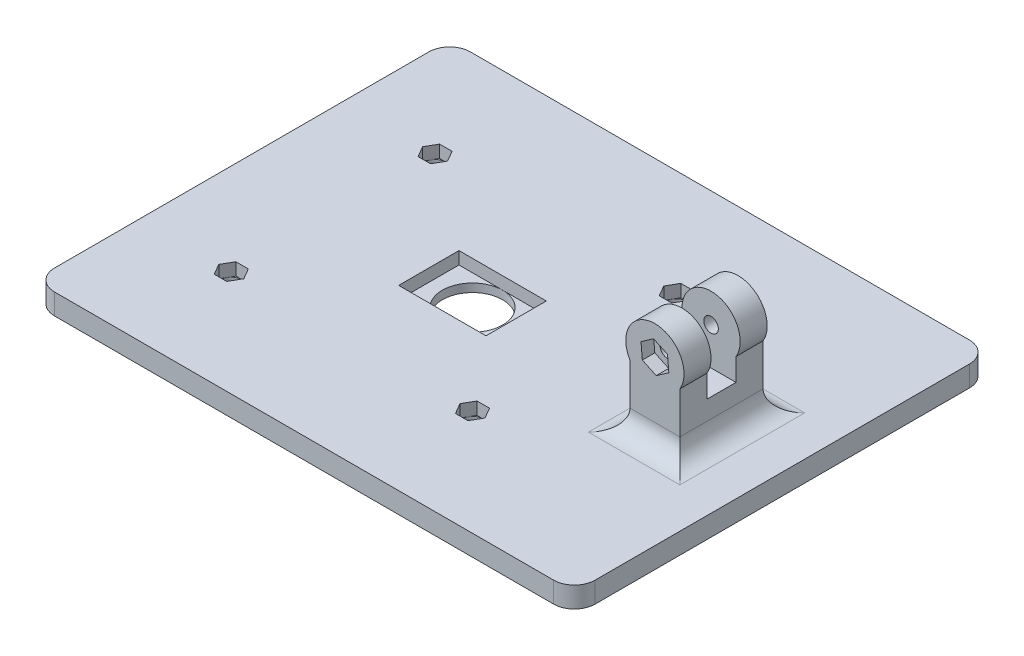
from build123d import *

# Parameters (mm, degrees)
ESQUISSE1_W                     = 130
ESQUISSE1_H                     = 100
BOSS_EXTRU_1_DEPTH              = 5
ENL_V_MAT_EXTRU_3_DEPTH         = 3
R_P_TITION_LIN_AIRE1_COUNT      = 2
R_P_TITION_LIN_AIRE1_PITCH      = 58
R_P_TITION_LIN_AIRE1_COUNT_DIR2 = 2
R_P_TITION_LIN_AIRE1_PITCH_DIR2 = 49
ESQUISSE8_R                     = 2.598076211
ENL_V_MAT_EXTRU_4_DEPTH         = 93.709474566
R_P_TITION_LIN_AIRE2_COUNT      = 2
R_P_TITION_LIN_AIRE2_PITCH      = 58
R_P_TITION_LIN_AIRE2_COUNT_DIR2 = 2
R_P_TITION_LIN_AIRE2_PITCH_DIR2 = 49
ESQUISSE9_W                     = 12
ESQUISSE9_H                     = 20
BOSS_EXTRU_2_DEPTH              = 15
BOSS_EXTRU_3_DEPTH              = 20
ESQUISSE14_W                    = 16
ESQUISSE14_H                    = 7
ENL_V_MAT_EXTRU_6_DEPTH         = 16
ENL_V_MAT_EXTRU_7_DEPTH         = 13
ESQUISSE18_R                    = 1.75
ENL_V_MAT_EXTRU_8_DEPTH         = 33
CONG_1_R                        = 5
CONG_2_R                        = 5
ESQUISSE19_W                    = 21
ESQUISSE19_H                    = 14.5
ENL_V_MAT_EXTRU_9_DEPTH         = 3
ESQUISSE20_R                    = 7.25
ENL_V_MAT_EXTRU_10_DEPTH        = 12


with BuildPart() as part:
    # Esquisse1 → Boss.-Extru.1 (new body)
    with BuildSketch(Plane(origin=(0, 0, 0), x_dir=(1, 0, 0), z_dir=(0, 1, 0))):
        with Locations((12.518489284, 0.605636973)):
            Rectangle(ESQUISSE1_W, ESQUISSE1_H)
    extrude(amount=BOSS_EXTRU_1_DEPTH)

    # Esquisse5 → Enlèv. mat.-Extru.3 (cut)
    with BuildSketch(Plane(origin=(0, 5, 0), x_dir=(1, 0, 0), z_dir=(0, 1, 0))):
        Polygon((-28.974508208, 22.511616263), (-27.48152163, 25.113729073), (-28.988524137, 27.707749783), (-31.988513224, 27.699657683), (-33.481499802, 25.097544873), (-31.974497295, 22.503524163), align=None)
    enl_v_mat_extru_3 = extrude(amount=-ENL_V_MAT_EXTRU_3_DEPTH, mode=Mode.SUBTRACT)

    # Répétition linéaire1: Enl_v. mat.-Extru.3 2 × 2
    with Locations(*[(i * R_P_TITION_LIN_AIRE1_PITCH, 0, j * R_P_TITION_LIN_AIRE1_PITCH_DIR2) for i in range(R_P_TITION_LIN_AIRE1_COUNT) for j in range(R_P_TITION_LIN_AIRE1_COUNT_DIR2) if (i, j) != (0, 0)]):
        add(enl_v_mat_extru_3, mode=Mode.SUBTRACT)

    # Esquisse8 → Enlèv. mat.-Extru.4 (cut, through all)
    with BuildSketch(Plane(origin=(0, 5, 0), x_dir=(1, 0, 0), z_dir=(0, 1, 0))):
        with Locations(Location((-30.481510716, 25.105636973, 0), (0, 0, 270))):
            Circle(ESQUISSE8_R)
    enl_v_mat_extru_4 = extrude(amount=-ENL_V_MAT_EXTRU_4_DEPTH, mode=Mode.SUBTRACT)

    # Répétition linéaire2: Enl_v. mat.-Extru.4 2 × 2
    with Locations(*[(i * R_P_TITION_LIN_AIRE2_PITCH, 0, j * R_P_TITION_LIN_AIRE2_PITCH_DIR2) for i in range(R_P_TITION_LIN_AIRE2_COUNT) for j in range(R_P_TITION_LIN_AIRE2_COUNT_DIR2) if (i, j) != (0, 0)]):
        add(enl_v_mat_extru_4, mode=Mode.SUBTRACT)

    # Esquisse9 → Boss.-Extru.2 (add)
    with BuildSketch(Plane(origin=(0, 5, 0), x_dir=(1, 0, 0), z_dir=(0, 1, 0))):
        with Locations((56.884872881, 0.605636973)):
            Rectangle(ESQUISSE9_W, ESQUISSE9_H)
    extrude(amount=BOSS_EXTRU_2_DEPTH)

    # Esquisse10 → Boss.-Extru.3 (add)
    with BuildSketch(Plane.XY.offset(9.394363027)):
        with BuildLine():
            Line((50.884872881, 20), (62.884872881, 20))
            ThreePointArc((62.884872881, 20), (56.884872881, 30.605551275), (50.884872881, 20))
        make_face()
    extrude(amount=-BOSS_EXTRU_3_DEPTH)

    # Esquisse14 → Enlèv. mat.-Extru.6 (cut)
    with BuildSketch(Plane(origin=(0, 30.605551275, 0), x_dir=(1, 0, 0), z_dir=(0, 1, 0))):
        with Locations((57.018489284, 0.605636973)):
            Rectangle(ESQUISSE14_W, ESQUISSE14_H)
    extrude(amount=-ENL_V_MAT_EXTRU_6_DEPTH, mode=Mode.SUBTRACT)

    # Esquisse17 → Enlèv. mat.-Extru.7 (cut)
    with BuildSketch(Plane.XY.offset(19.394363027)):
        Polygon((60.23131756, 22.03882177), (59.914922773, 25.720292627), (56.568478094, 27.287022133), (53.538428202, 25.172280781), (53.854822989, 21.490809924), (57.201267668, 19.924080418), align=None)
    extrude(amount=-ENL_V_MAT_EXTRU_7_DEPTH, mode=Mode.SUBTRACT)

    # Esquisse18 → Enlèv. mat.-Extru.8 (cut)
    with BuildSketch(Plane.XY.offset(19.394363027)):
        with Locations((56.884872881, 23.605551275)):
            Circle(ESQUISSE18_R)
    extrude(amount=-ENL_V_MAT_EXTRU_8_DEPTH, mode=Mode.SUBTRACT)

    # Congé1
    cong_1_edges = [part.edges().sort_by_distance(p)[0] for p in [
        (50.884872881, 5, -0.605636973),
        (56.884872881, 5, 9.394363027),
        (62.884872881, 5, -0.605636973),
        (56.884872881, 5, -10.605636973),
    ]]
    fillet(cong_1_edges, radius=CONG_1_R)

    # Congé2
    cong_2_edges = [part.edges().sort_by_distance(p)[0] for p in [
        (-52.481510716, 2.5, -50.605636973),
        (77.518489284, 2.5, -50.605636973),
        (77.518489284, 2.5, 49.394363027),
        (-52.481510716, 2.5, 49.394363027),
    ]]
    fillet(cong_2_edges, radius=CONG_2_R)

    # Esquisse19 → Enlèv. mat.-Extru.9 (cut)
    with BuildSketch(Plane(origin=(0, 5, 0), x_dir=(1, 0, 0), z_dir=(0, 1, 0))):
        with Locations((3.018489284, 0.605636973)):
            Rectangle(ESQUISSE19_W, ESQUISSE19_H)
    extrude(amount=-ENL_V_MAT_EXTRU_9_DEPTH, mode=Mode.SUBTRACT)

    # Esquisse20 → Enlèv. mat.-Extru.10 (cut)
    with BuildSketch(Plane(origin=(0, 5, 0), x_dir=(1, 0, 0), z_dir=(0, 1, 0))):
        with Locations(Location((3.018489284, 0.605636973, 0), (0, 0, 270))):
            Circle(ESQUISSE20_R)
    extrude(amount=-ENL_V_MAT_EXTRU_10_DEPTH, mode=Mode.SUBTRACT)


solid = part.part
